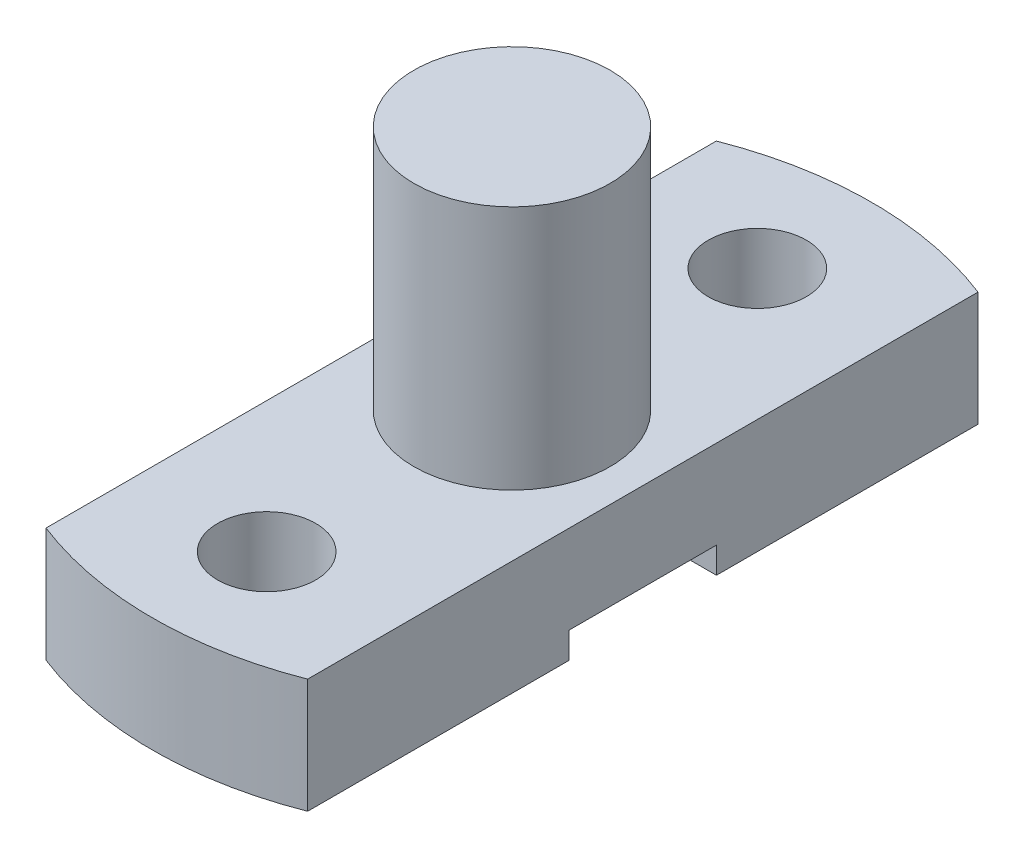
from build123d import *

# Parameters (mm, degrees)
SKETCH1_R           = 30
BOSS_EXTRUDE1_DEPTH = 110
SKETCH1_3_R         = 15
SKETCH1_3_R_2       = 30
BOSS_EXTRUDE2_DEPTH = 35
SKETCH2_W           = 45
SKETCH2_H           = 8
CUT_EXTRUDE2_DEPTH  = 175.928556845


with BuildPart() as part:
    # Sketch1 → Boss-Extrude1 (new body)
    with BuildSketch(Plane(origin=(0, 0, 0), x_dir=(1, 0, 0), z_dir=(0, 1, 0))):
        Circle(SKETCH1_R)
    extrude(amount=BOSS_EXTRUDE1_DEPTH)

    # Sketch1<3> → Boss-Extrude2 (add)
    with BuildSketch(Plane(origin=(0, 0, 0), x_dir=(1, 0, 0), z_dir=(0, 1, 0))):
        with BuildLine():
            ThreePointArc((40, 102.46950766), (0, 110), (-40, 102.46950766))
            Line((-40, 102.46950766), (-40, -102.46950766))
            ThreePointArc((-40, -102.46950766), (0, -110), (40, -102.46950766))
            Line((40, -102.46950766), (40, 102.46950766))
        make_face()
        with Locations((0, -75)):
            Circle(SKETCH1_3_R, mode=Mode.SUBTRACT)
        Circle(SKETCH1_3_R_2, mode=Mode.SUBTRACT)
        with Locations((0, 75)):
            Circle(SKETCH1_3_R, mode=Mode.SUBTRACT)
    extrude(amount=BOSS_EXTRUDE2_DEPTH)

    # Sketch2 → Cut-Extrude2 (cut, through all)
    with BuildSketch(Plane(origin=(40, 0, 0), x_dir=(0, 0, -1), z_dir=(1, 0, 0))):
        with Locations((0, 4)):
            Rectangle(SKETCH2_W, SKETCH2_H)
    extrude(amount=-CUT_EXTRUDE2_DEPTH, mode=Mode.SUBTRACT)


solid = part.part
